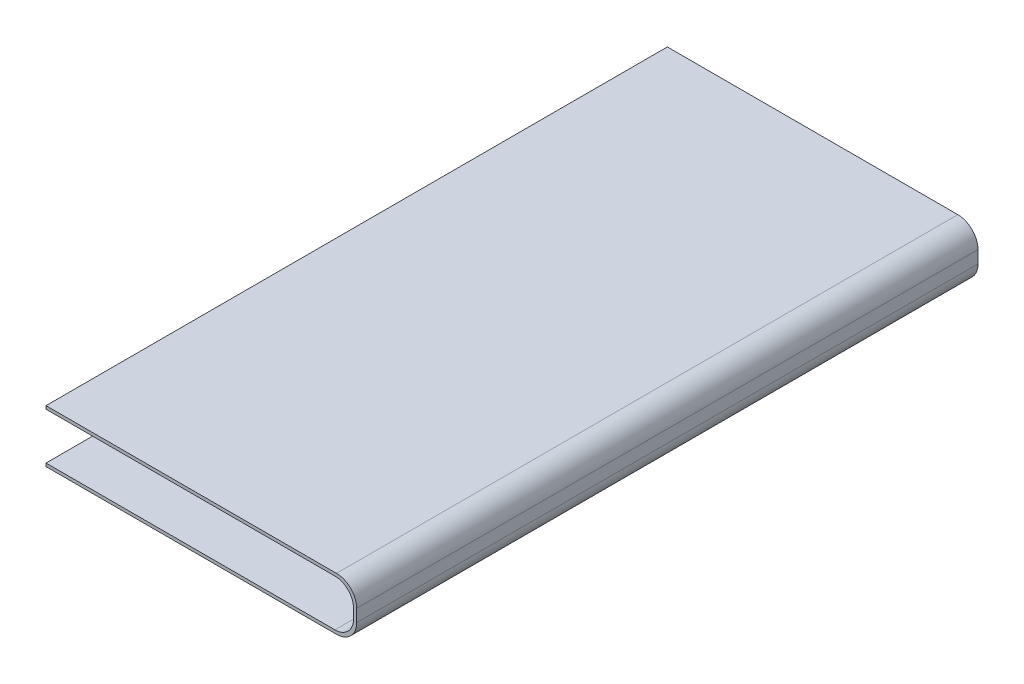
from build123d import *

# Parameters (mm, degrees)
EXTRUDE_1_DEPTH = 10


with BuildPart() as part:
    # Эскиз1 → Бобышка-Вытянуть1 (new, symmetric)
    with BuildSketch(Plane.XY):
        with BuildLine():
            Line((14.4, -1.65), (23.75, -1.65))
            ThreePointArc((23.75, -1.65), (24.209619408, -1.840380592), (24.4, -2.3))
            Line((24.4, -2.3), (24.4, -2.7))
            ThreePointArc((24.4, -2.7), (24.209619408, -3.159619408), (23.75, -3.35))
            Line((23.75, -3.35), (14.4, -3.35))
            Line((14.4, -3.35), (14.4, -3.25))
            Line((14.4, -3.25), (23.7, -3.25))
            ThreePointArc((23.7, -3.25), (24.124264069, -3.074264069), (24.3, -2.65))
            Line((24.3, -2.65), (24.3, -2.35))
            ThreePointArc((24.3, -2.35), (24.124264069, -1.925735931), (23.7, -1.75))
            Line((23.7, -1.75), (14.4, -1.75))
            Line((14.4, -1.75), (14.4, -1.65))
        make_face()
    extrude(amount=EXTRUDE_1_DEPTH, both=True)


solid = part.part
